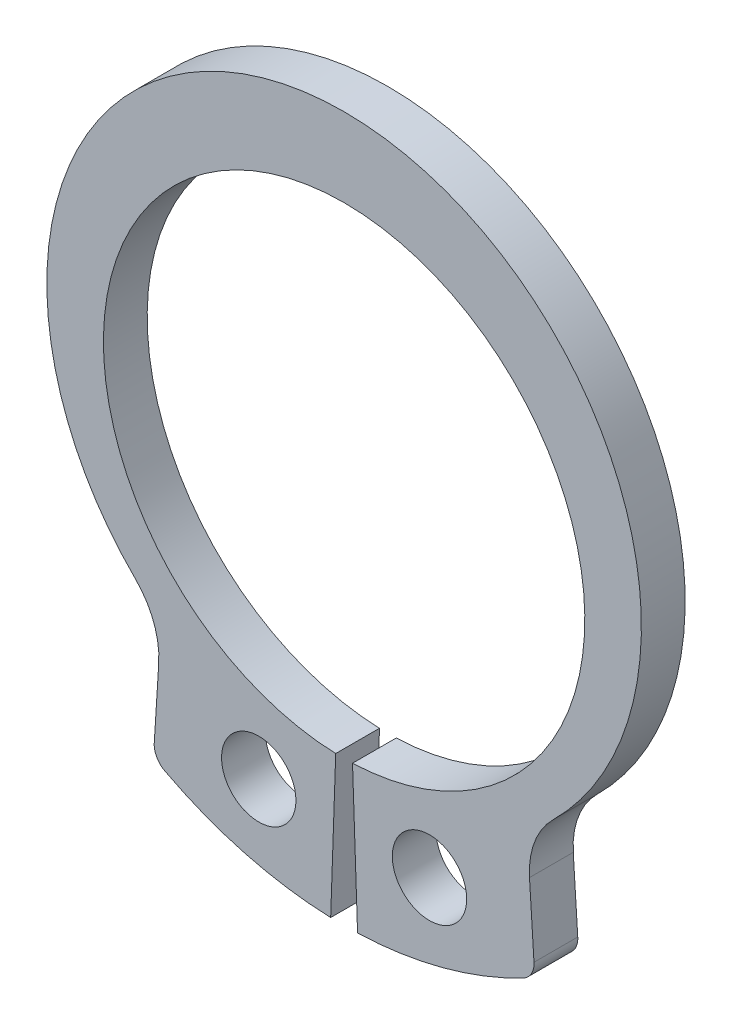
from build123d import *

# Parameters (mm, degrees)
SKETCH4_R           = 0.85
BOSS_EXTRUDE1_DEPTH = 0.5
FILLET1_R           = 1.826259158
FILLET2_R           = 0.456564789


with BuildPart() as part:
    # Sketch4 → Boss-Extrude1 (new, symmetric)
    with BuildSketch(Plane.XY):
        with BuildLine():
            Line((-4.356605307, -7.652086329), (-4.179645962, -4.84670606))
            ThreePointArc((-4.179645962, -4.84670606), (-6.422848054, 2.717628201), (0, 7.3))
            Line((0, 7.3), (0, 5.5))
            ThreePointArc((0, 5.5), (-5.499162323, 0.095988235), (-0.191947232, -5.496649549))
            Line((-0.191947232, -5.496649549), (-0.307302772, -8.8))
            ThreePointArc((-0.307302772, -8.8), (-2.401548686, -8.471540527), (-4.356605307, -7.652086329))
        make_face()
        with Locations((-1.950801133, -6.88151398)):
            Circle(SKETCH4_R, mode=Mode.SUBTRACT)
    extrude(amount=BOSS_EXTRUDE1_DEPTH, both=True)

    # Fillet1
    fillet1_edges = [part.edges().sort_by_distance(p)[0] for p in [
        (-4.179645962, -4.84670606, 0),
    ]]
    fillet(fillet1_edges, radius=FILLET1_R)

    # Fillet2
    fillet2_edges = [part.edges().sort_by_distance(p)[0] for p in [
        (-4.356605307, -7.652086329, 0),
    ]]
    fillet(fillet2_edges, radius=FILLET2_R)

    # Mirror1: part across plane


with BuildPart() as part_1:
    add(part.part)
    add(part.part.mirror(Plane(origin=(0, 7.3, 0.5), x_dir=(0, 0, 1), z_dir=(-1, 0, 0))))


solid = part_1.part
